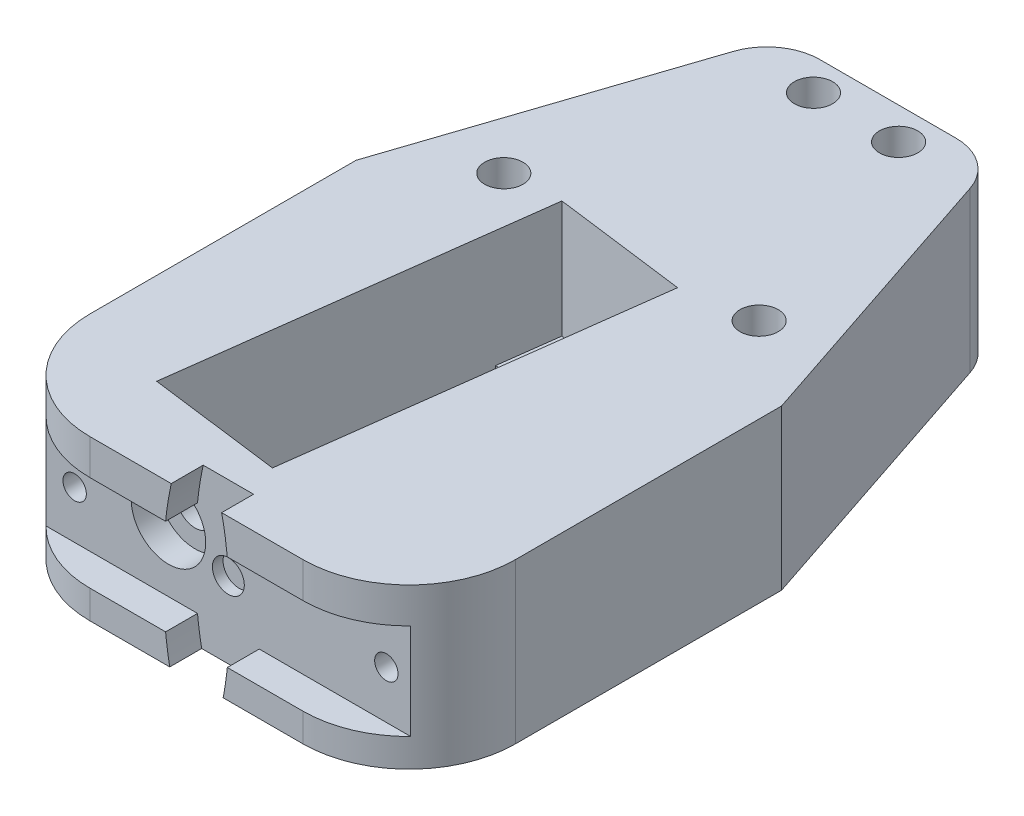
from build123d import *

# Parameters (mm, degrees)
BOSS_EXTRUDE1_DEPTH = 15
SKETCH2_R           = 1.8
CUT_EXTRUDE1_DEPTH  = 56.901699437
FILLET2_R           = 5
CUT_EXTRUDE2_DEPTH  = 56.901699437
CUT_EXTRUDE3_DEPTH  = 11
SKETCH3_R           = 1.2
CUT_EXTRUDE4_DEPTH  = 11
FILLET3_R           = 10
SKETCH4_R           = 1.1
CUT_EXTRUDE5_DEPTH  = 3
SKETCH4_2_R         = 1.1
CUT_EXTRUDE6_DEPTH  = 8
SKETCH4_4_R         = 1.5
CUT_EXTRUDE7_DEPTH  = 4
CUT_EXTRUDE8_DEPTH  = 4
SKETCH6_R           = 3.5
SKETCH6_R_2         = 1.8
CUT_EXTRUDE9_DEPTH  = 2.5
SKETCH6_2_R         = 1.8
CUT_EXTRUDE10_DEPTH = 13.5


with BuildPart() as part:
    # Sketch1 → Boss-Extrude1 (new body)
    with BuildSketch(Plane(origin=(0, 0, 0), x_dir=(1, 0, 0), z_dir=(0, 1, 0))):
        Polygon((-10, 15), (-20, -15), (-20, -50), (20, -50), (20, -15), (10, 15), align=None)
    extrude(amount=BOSS_EXTRUDE1_DEPTH)

    # Sketch2 → Cut-Extrude1 (cut, through all)
    with BuildSketch(Plane(origin=(0, 15, 0), x_dir=(1, 0, 0), z_dir=(0, 1, 0))):
        with Locations((-4, 12)):
            Circle(SKETCH2_R)
        with Locations((4, 12)):
            Circle(SKETCH2_R)
        with Locations((12, -9.11)):
            Circle(SKETCH2_R)
        with Locations((-12, -9.11)):
            Circle(SKETCH2_R)
    extrude(amount=-CUT_EXTRUDE1_DEPTH, mode=Mode.SUBTRACT)

    # Fillet2
    fillet2_edges = [part.edges().sort_by_distance(p)[0] for p in [
        (-10, 7.5, -15),
        (10, 7.5, -15),
    ]]
    fillet(fillet2_edges, radius=FILLET2_R)

    # Sketch2<3> → Cut-Extrude2 (cut, through all)
    with BuildSketch(Plane(origin=(0, 15, 0), x_dir=(1, 0, 0), z_dir=(0, 1, 0))):
        Polygon((-10.666887738, -36.852464686), (1.828807817, -38.470362271), (4.769272475, -15.75993146), (-7.72642308, -14.142033875), align=None)
    extrude(amount=-CUT_EXTRUDE2_DEPTH, mode=Mode.SUBTRACT)

    # Sketch2<4> → Cut-Extrude3 (cut)
    with BuildSketch(Plane(origin=(0, 15, 0), x_dir=(1, 0, 0), z_dir=(0, 1, 0))):
        Polygon((1.116162452, -43.974418646), (1.828807817, -38.470362271), (-10.666887738, -36.852464686), (-11.379533103, -42.356521061), align=None)
        Polygon((-7.72642308, -14.142033875), (4.769272475, -15.75993146), (5.481917839, -10.255875085), (-7.013777716, -8.6379775), align=None)
    extrude(amount=-CUT_EXTRUDE3_DEPTH, mode=Mode.SUBTRACT)

    # Sketch3 → Cut-Extrude4 (cut)
    with BuildSketch(Plane(origin=(0, 4, 0), x_dir=(1, 0, 0), z_dir=(0, 1, 0))):
        with Locations((-1.293710172, -12.504467624)):
            Circle(SKETCH3_R)
        with Locations((-4.863357224, -40.074335595)):
            Circle(SKETCH3_R)
    extrude(amount=-CUT_EXTRUDE4_DEPTH, mode=Mode.SUBTRACT)

    # Fillet3
    fillet3_edges = [part.edges().sort_by_distance(p)[0] for p in [
        (20, 7.5, 50),
        (-20, 7.5, 50),
    ]]
    fillet(fillet3_edges, radius=FILLET3_R)

    # Sketch4 → Cut-Extrude5 (cut)
    with BuildSketch(Plane.XY.offset(50)):
        with BuildLine():
            Line((19, 2.663134509), (19, 11.663134509))
            Line((19, 11.663134509), (2.90110314, 11.663134509))
            add(Edge.make_bspline(
                [(2.90110314, 11.663134509), (2.706802795, 13.50022371), (2.368423756, 15)],
                knots=[5.097231356, 5.097231356, 5.097231356, 5.477961769, 5.477961769, 5.477961769], degree=2, weights=[1, 0.899743473, 0.831672604]))
            Line((2.368423756, 15), (-2.368423756, 15))
            add(Edge.make_bspline(
                [(-2.368423756, 15), (-2.706802795, 13.50022371), (-2.90110314, 11.663134509)],
                knots=[7.088408845, 7.088408845, 7.088408845, 7.469139258, 7.469139258, 7.469139258], degree=2, weights=[0.831672604, 0.899743473, 1]))
            Line((-2.90110314, 11.663134509), (-19, 11.663134509))
            Line((-19, 11.663134509), (-19, 2.663134509))
            Line((-19, 2.663134509), (-2.90110314, 2.663134509))
            add(Edge.make_bspline(
                [(-2.90110314, 2.663134509), (-2.750081515, 1.235241026), (-2.509684133, 0)],
                knots=[1.955638703, 1.955638703, 1.955638703, 2.258324061, 2.258324061, 2.258324061], degree=2, weights=[1, 0.920294828, 0.860932427]))
            Line((-2.509684133, 0), (2.509684133, 0))
            add(Edge.make_bspline(
                [(2.509684133, 0), (2.750081515, 1.235241026), (2.90110314, 2.663134509)],
                knots=[4.024861246, 4.024861246, 4.024861246, 4.327546605, 4.327546605, 4.327546605], degree=2, weights=[0.860932427, 0.920294828, 1]))
            Line((2.90110314, 2.663134509), (19, 2.663134509))
        make_face()
        with Locations((14.85, 7.163134509)):
            Circle(SKETCH4_R, mode=Mode.SUBTRACT)
        with Locations((-14.45, 7.163134509)):
            Circle(SKETCH4_R, mode=Mode.SUBTRACT)
    extrude(amount=-CUT_EXTRUDE5_DEPTH, mode=Mode.SUBTRACT)

    # Sketch4<2> → Cut-Extrude6 (cut)
    with BuildSketch(Plane.XY.offset(50)):
        with Locations((-14.45, 7.163134509)):
            Circle(SKETCH4_2_R)
        with Locations((14.85, 7.163134509)):
            Circle(SKETCH4_2_R)
    extrude(amount=-CUT_EXTRUDE6_DEPTH, mode=Mode.SUBTRACT)

    # Sketch4<4> → Cut-Extrude7 (cut)
    with BuildSketch(Plane.XY.offset(50)):
        with Locations((0, 7.163134509)):
            Circle(SKETCH4_4_R)
    extrude(amount=-CUT_EXTRUDE7_DEPTH, mode=Mode.SUBTRACT)

    # Sketch5 → Cut-Extrude8 (cut)
    with BuildSketch(Plane(origin=(0, 4, 0), x_dir=(1, 0, 0), z_dir=(0, 1, 0))):
        with BuildLine():
            Line((-2.435596222, -37.918222619), (-6.402483699, -37.404604338))
            Line((-6.402483699, -37.404604338), (-6.65929284, -39.388048077))
            Line((-6.65929284, -39.388048077), (-5.908796102, -39.485219687))
            ThreePointArc((-5.908796102, -39.485219687), (-4.70927174, -38.884269352), (-3.702354234, -39.770901821))
            Line((-3.702354234, -39.770901821), (-2.692405362, -39.901666358))
            Line((-2.692405362, -39.901666358), (-2.435596222, -37.918222619))
        make_face()
    extrude(amount=-CUT_EXTRUDE8_DEPTH, mode=Mode.SUBTRACT)

    # Sketch6 → Cut-Extrude9 (cut)
    with BuildSketch(Plane.XY.offset(47)):
        with Locations((-5.628460917, 8.8)):
            Circle(SKETCH6_R)
        with Locations((-5.628460917, 8.8)):
            Circle(SKETCH6_R_2, mode=Mode.SUBTRACT)
    extrude(amount=-CUT_EXTRUDE9_DEPTH, mode=Mode.SUBTRACT)

    # Sketch6<2> → Cut-Extrude10 (cut)
    with BuildSketch(Plane.XY.offset(47)):
        with Locations((-5.628460917, 8.8)):
            Circle(SKETCH6_2_R)
    extrude(amount=-CUT_EXTRUDE10_DEPTH, mode=Mode.SUBTRACT)


solid = part.part
